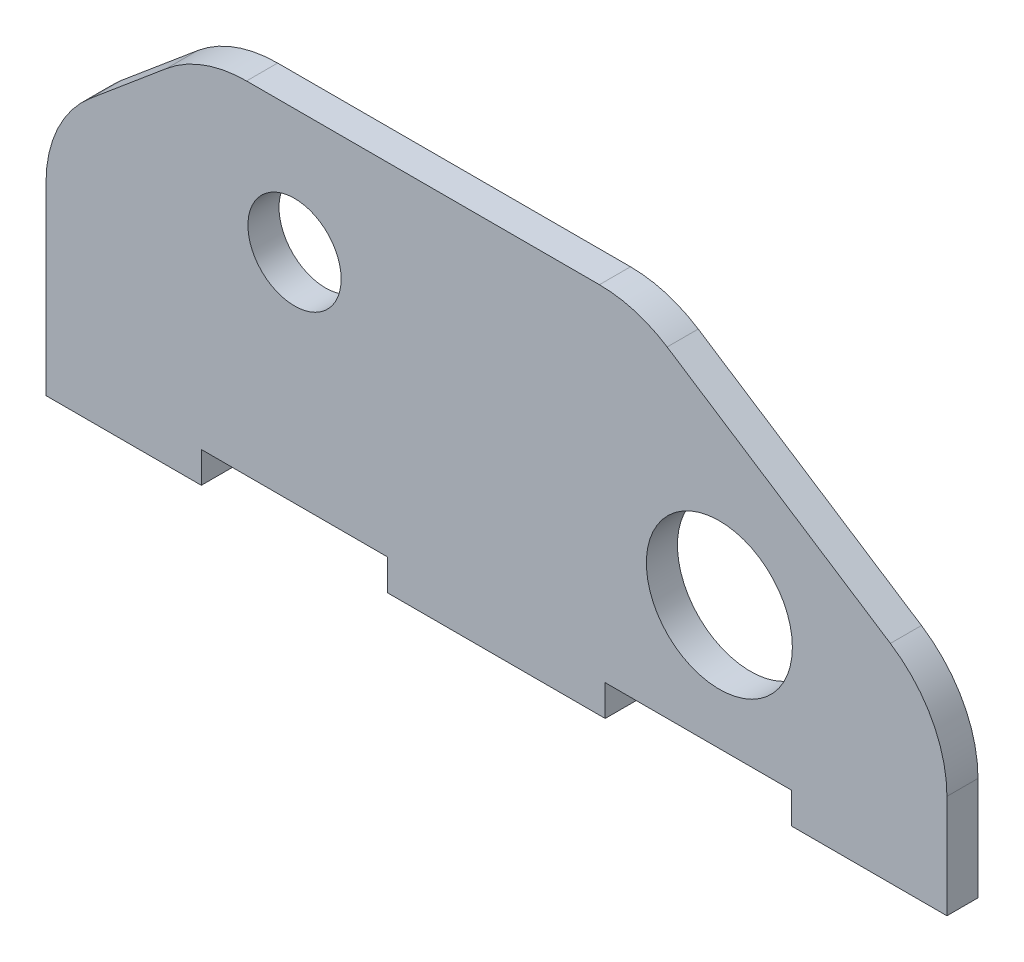
from build123d import *

# Parameters (mm, degrees)
ESQUISSE1_R        = 15
ESQUISSE1_R_2      = 23.5
BOSS_EXTRU_1_DEPTH = 10
CONG_1_R           = 40


with BuildPart() as part:
    # Esquisse1 → Boss.-Extru.1 (new body)
    with BuildSketch(Plane.XY):
        Polygon((290, 0), (290, 55), (190, 120), (50, 120), (0, 78.045018441), (0, 0), (50, 0), (50, 10), (110, 10), (110, 0), (180, 0), (180, 10), (240, 10), (240, 0), align=None)
        with Locations((80, 80)):
            Circle(ESQUISSE1_R, mode=Mode.SUBTRACT)
        with Locations((216.747943312, 50)):
            Circle(ESQUISSE1_R_2, mode=Mode.SUBTRACT)
    extrude(amount=BOSS_EXTRU_1_DEPTH)

    # Congé1
    cong_1_edges = [part.edges().sort_by_distance(p)[0] for p in [
        (0, 78.045018441, 5),
        (50, 120, 5),
        (190, 120, 5),
        (290, 55, 5),
    ]]
    fillet(cong_1_edges, radius=CONG_1_R)


solid = part.part
